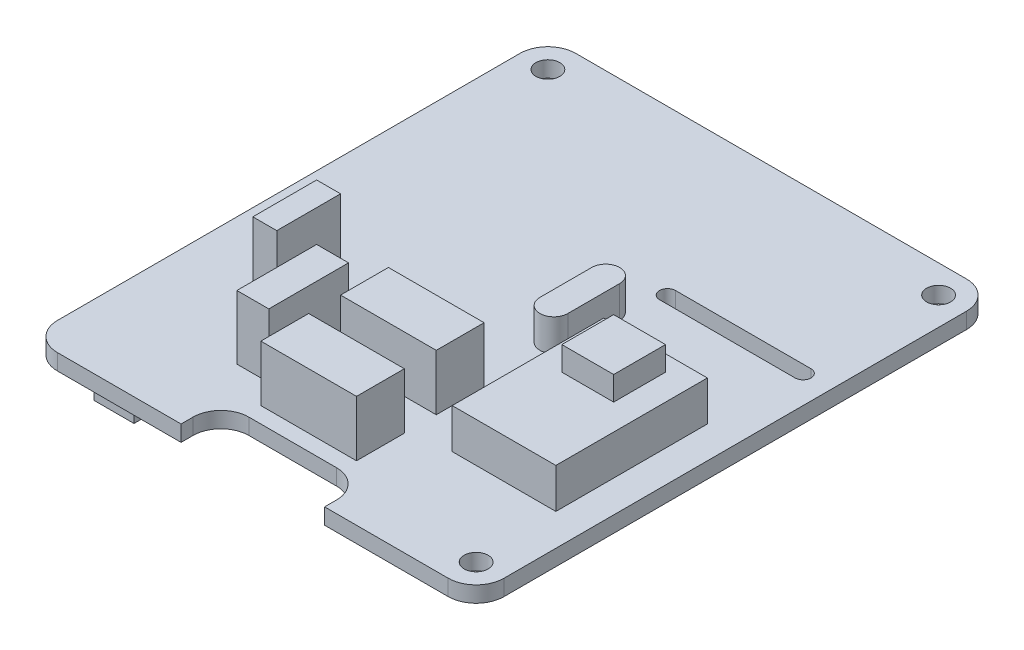
from build123d import *

# Parameters (mm, degrees)
EXTRUDE_610_DEPTH      = 2
SKETCH_2_R             = 1.5
CUT_EXTRUDE_906_DEPTH  = 43.944731924
CUT_EXTRUDE_1170_DEPTH = 43.944731924
SKETCH_4_W             = 5
SKETCH_4_H             = 50.8
EXTRUDE_1451_DEPTH     = 8
SKETCH_5_W             = 12
SKETCH_5_H             = 6
CAN_DEPTH              = 7
PATTERN_LINEAR_1_COUNT = 2
PATTERN_LINEAR_1_PITCH = 10
SKETCH_6_W             = 4
SKETCH_6_H             = 10
EXTRUDE_2243_DEPTH     = 8
SKETCH_7_W             = 13
SKETCH_7_H             = 19
EXTRUDE_2697_DEPTH     = 5
SKETCH_8_W             = 6.5
SKETCH_8_H             = 6.5
EXTRUDE_2917_DEPTH     = 3
SKETCH_9_W             = 3
SKETCH_9_H             = 8
UART_DEPTH             = 8
EXTRUDE_3952_DEPTH     = 4
FILLET_1_R             = 3.5


with BuildPart() as part:
    # Эскиз1 → Extrude 610 (new body)
    with BuildSketch(Plane(origin=(0, 0, 0), x_dir=(1, 0, 0), z_dir=(0, 1, 0))):
        Polygon((-28, 32.5), (28, 32.5), (28, -32.5), (9, -32.5), (9, -27.5), (-9, -27.5), (-9, -32.5), (-28, -32.5), align=None)
    extrude(amount=EXTRUDE_610_DEPTH)

    # Эскиз2 → Cut-Extrude 906 (cut, through all)
    with BuildSketch(Plane(origin=(0, 2, 0), x_dir=(1, 0, 0), z_dir=(0, 1, 0))):
        with Locations(Location((-24.5, 29, 0), (0, 0, 270))):
            Circle(SKETCH_2_R)
        with Locations(Location((24.5, 29, 0), (0, 0, 270))):
            Circle(SKETCH_2_R)
        with Locations(Location((24.5, -29, 0), (0, 0, 270))):
            Circle(SKETCH_2_R)
    extrude(amount=-CUT_EXTRUDE_906_DEPTH, mode=Mode.SUBTRACT)

    # Эскиз3 → Cut-Extrude 1170 (cut, through all)
    with BuildSketch(Plane(origin=(0, 2, 0), x_dir=(1, 0, 0), z_dir=(0, 1, 0))):
        with BuildLine():
            Line((7.5, 13), (24.5, 13))
            ThreePointArc((24.5, 13), (25.5, 12), (24.5, 11))
            Line((24.5, 11), (7.5, 11))
            ThreePointArc((7.5, 11), (6.5, 12), (7.5, 13))
        make_face()
    extrude(amount=-CUT_EXTRUDE_1170_DEPTH, mode=Mode.SUBTRACT)

    # Эскиз4 → Extrude 1451 (add)
    with BuildSketch(Plane.XZ):
        with Locations((-24.5, 0)):
            Rectangle(SKETCH_4_W, SKETCH_4_H)
    extrude(amount=EXTRUDE_1451_DEPTH)

    # Эскиз5 → CAN разъем (add)
    with BuildSketch(Plane(origin=(0, 2, 0), x_dir=(1, 0, 0), z_dir=(0, 1, 0))):
        with Locations((0, -22.5)):
            Rectangle(SKETCH_5_W, SKETCH_5_H)
    can = extrude(amount=CAN_DEPTH)

    # Линейный массив1: CAN разъем ×2
    with Locations(*[(0, 0, -i * PATTERN_LINEAR_1_PITCH) for i in range(1, PATTERN_LINEAR_1_COUNT)]):
        add(can)

    # Эскиз6 → Extrude 2243 (add)
    with BuildSketch(Plane(origin=(0, 2, 0), x_dir=(1, 0, 0), z_dir=(0, 1, 0))):
        with Locations((-10, -17.5)):
            Rectangle(SKETCH_6_W, SKETCH_6_H)
    extrude(amount=EXTRUDE_2243_DEPTH)

    # Эскиз7 → Extrude 2697 (add)
    with BuildSketch(Plane(origin=(0, 2, 0), x_dir=(1, 0, 0), z_dir=(0, 1, 0))):
        with Locations((17.5, -9)):
            Rectangle(SKETCH_7_W, SKETCH_7_H)
    extrude(amount=EXTRUDE_2697_DEPTH)

    # Эскиз8 → Extrude 2917 (add)
    with BuildSketch(Plane(origin=(0, 7, 0), x_dir=(1, 0, 0), z_dir=(0, 1, 0))):
        with Locations((17.5, -4.75)):
            Rectangle(SKETCH_8_W, SKETCH_8_H)
    extrude(amount=EXTRUDE_2917_DEPTH)

    # Эскиз9 → uart (add)
    with BuildSketch(Plane(origin=(0, 2, 0), x_dir=(1, 0, 0), z_dir=(0, 1, 0))):
        with Locations((-17.5, -9.5)):
            Rectangle(SKETCH_9_W, SKETCH_9_H)
    extrude(amount=UART_DEPTH)

    # Эскиз10 → Extrude 3952 (add)
    with BuildSketch(Plane(origin=(0, 2, 0), x_dir=(1, 0, 0), z_dir=(0, 1, 0))):
        with BuildLine():
            Line((3.75, -0.25), (3.75, 6.25))
            ThreePointArc((3.75, 6.25), (5.5, 8), (7.25, 6.25))
            Line((7.25, 6.25), (7.25, -0.25))
            ThreePointArc((7.25, -0.25), (5.5, -2), (3.75, -0.25))
        make_face()
    extrude(amount=EXTRUDE_3952_DEPTH)

    # Скругление1
    fillet_1_edges = [part.edges().sort_by_distance(p)[0] for p in [
        (-28, 1, -32.5),
        (28, 1, -32.5),
        (28, 1, 32.5),
        (9, 1, 27.5),
        (-9, 1, 27.5),
        (-28, 1, 32.5),
    ]]
    fillet(fillet_1_edges, radius=FILLET_1_R)


solid = part.part
